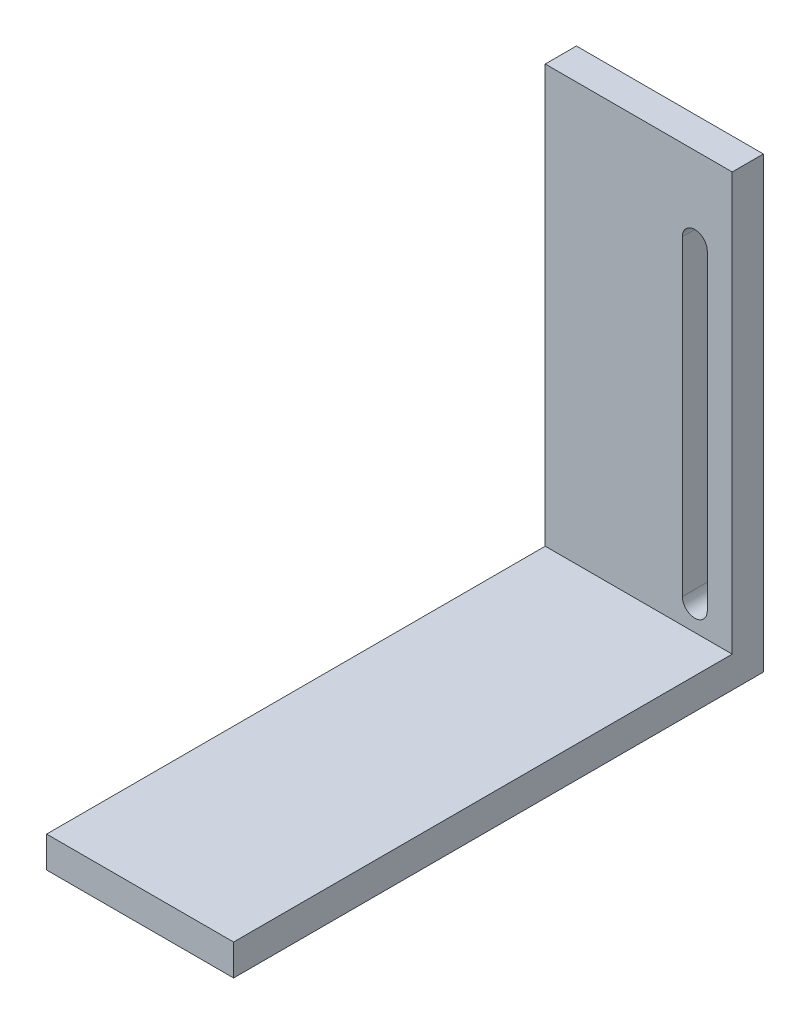
from build123d import *

# Parameters (mm, degrees)
SKETCH1_W           = 38.1
SKETCH1_H           = 91.44
BOSS_EXTRUDE1_DEPTH = 6.35
SKETCH2_W           = 38.1
SKETCH2_H           = 6.35
BOSS_EXTRUDE2_DEPTH = 101.6


with BuildPart() as part:
    # Sketch1 → Boss-Extrude1 (new body)
    with BuildSketch(Plane.XY):
        with Locations((19.05, 45.72)):
            Rectangle(SKETCH1_W, SKETCH1_H)
        with BuildLine():
            Line((33.02, 74.93), (33.02, 11.43))
            ThreePointArc((33.02, 11.43), (30.48, 8.89), (27.94, 11.43))
            Line((27.94, 11.43), (27.94, 74.93))
            ThreePointArc((27.94, 74.93), (30.48, 77.47), (33.02, 74.93))
        make_face(mode=Mode.SUBTRACT)
    extrude(amount=BOSS_EXTRUDE1_DEPTH)

    # Sketch2 → Boss-Extrude2 (add)
    with BuildSketch(Plane.XY.offset(6.35)):
        with Locations((19.05, 3.175)):
            Rectangle(SKETCH2_W, SKETCH2_H)
    extrude(amount=BOSS_EXTRUDE2_DEPTH)


solid = part.part
